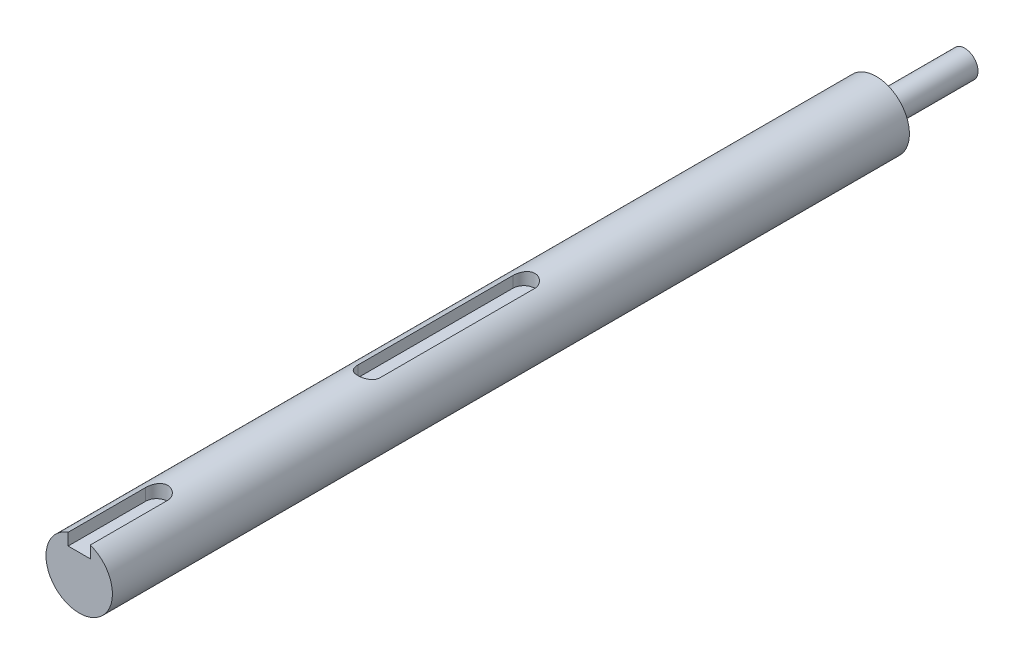
from build123d import *

# Parameters (mm, degrees)
SKETCH1_R           = 7.5
BOSS_EXTRUDE1_DEPTH = 200
SKETCH2_R           = 7.5
SKETCH2_R_2         = 3
CUT_EXTRUDE1_DEPTH  = 20
CUT_EXTRUDE3_START  = 10
CUT_EXTRUDE3_DEPTH  = 12.5
CUT_EXTRUDE4_START  = 10
CUT_EXTRUDE4_DEPTH  = 12.7


with BuildPart() as part:
    # Sketch1 → Boss-Extrude1 (new body)
    with BuildSketch(Plane.XY):
        Circle(SKETCH1_R)
    extrude(amount=BOSS_EXTRUDE1_DEPTH)

    # Sketch2 → Cut-Extrude1 (cut)
    with BuildSketch(Plane(origin=(0, 0, 0), x_dir=(-1, 0, 0), z_dir=(0, 0, -1))):
        Circle(SKETCH2_R)
        Circle(SKETCH2_R_2, mode=Mode.SUBTRACT)
    extrude(amount=-CUT_EXTRUDE1_DEPTH, mode=Mode.SUBTRACT)

    # Sketch5 → Cut-Extrude3 (cut)
    with BuildSketch(Plane(origin=(0, 7.071067812, 0), x_dir=(1, 0, 0), z_dir=(0, 1, 0)).offset(CUT_EXTRUDE3_START)):
        with BuildLine():
            Line((2.5, -99.5781), (2.5, -134.5781))
            ThreePointArc((2.5, -134.5781), (0, -137.0781), (-2.5, -134.5781))
            Line((-2.5, -134.5781), (-2.5, -99.5781))
            ThreePointArc((-2.5, -99.5781), (0, -97.0781), (2.5, -99.5781))
        make_face()
    extrude(amount=-CUT_EXTRUDE3_DEPTH, mode=Mode.SUBTRACT)

    # Sketch6 → Cut-Extrude4 (cut)
    with BuildSketch(Plane(origin=(0, 7.071067812, 0), x_dir=(1, 0, 0), z_dir=(0, 1, 0)).offset(CUT_EXTRUDE4_START)):
        with BuildLine():
            Line((-2.5, -200), (-2.5, -182.5))
            ThreePointArc((-2.5, -182.5), (0, -180), (2.5, -182.5))
            Line((2.5, -182.5), (2.5, -200))
            ThreePointArc((2.5, -200), (0, -202.5), (-2.5, -200))
        make_face()
    extrude(amount=-CUT_EXTRUDE4_DEPTH, mode=Mode.SUBTRACT)


solid = part.part
